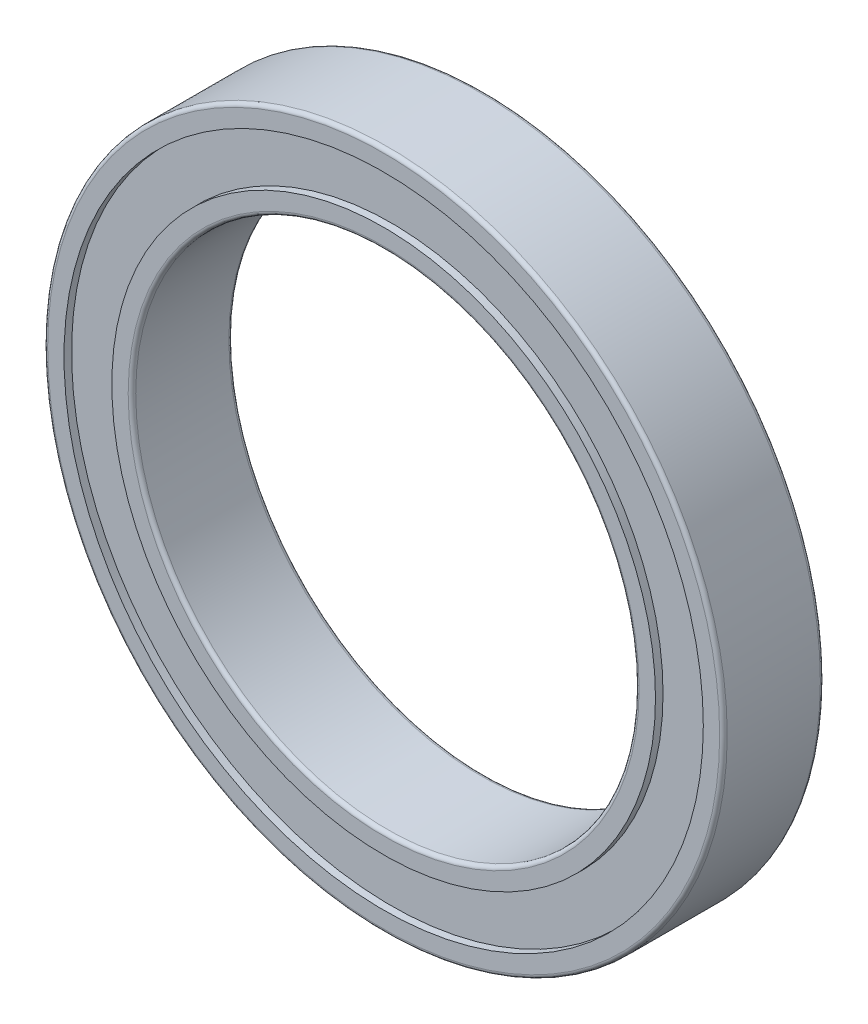
from build123d import *

# Parameters (mm, degrees)
SKETCH1_R           = 13.5
SKETCH1_R_2         = 10
BOSS_EXTRUDE1_DEPTH = 4
SKETCH2_R           = 12.7
SKETCH2_R_2         = 10.8
CUT_EXTRUDE1_DEPTH  = 0.3
CUT_EXTRUDE2_START  = -3.5
SKETCH2_2_R         = 12.7
SKETCH2_2_R_2       = 10.8
CUT_EXTRUDE2_DEPTH  = 0.5
FILLET1_R           = 0.15


with BuildPart() as part:
    # Sketch1 → Boss-Extrude1 (new body)
    with BuildSketch(Plane.XY):
        Circle(SKETCH1_R)
        Circle(SKETCH1_R_2, mode=Mode.SUBTRACT)
    extrude(amount=BOSS_EXTRUDE1_DEPTH)

    # Sketch2 → Cut-Extrude1 (cut)
    with BuildSketch(Plane.XY.offset(4)):
        Circle(SKETCH2_R)
        Circle(SKETCH2_R_2, mode=Mode.SUBTRACT)
    extrude(amount=-CUT_EXTRUDE1_DEPTH, mode=Mode.SUBTRACT)

    # Sketch2<2> → Cut-Extrude2 (cut)
    with BuildSketch(Plane.XY.offset(4).offset(CUT_EXTRUDE2_START)):
        Circle(SKETCH2_2_R)
        Circle(SKETCH2_2_R_2, mode=Mode.SUBTRACT)
    extrude(amount=-CUT_EXTRUDE2_DEPTH, mode=Mode.SUBTRACT)

    # Fillet1
    fillet1_edges = [part.edges().sort_by_distance(p)[0] for p in [
        (-13.5, 0, 0),
        (-13.5, 0, 4),
        (-10, 0, 0),
        (-10, 0, 4),
    ]]
    fillet(fillet1_edges, radius=FILLET1_R)


solid = part.part
